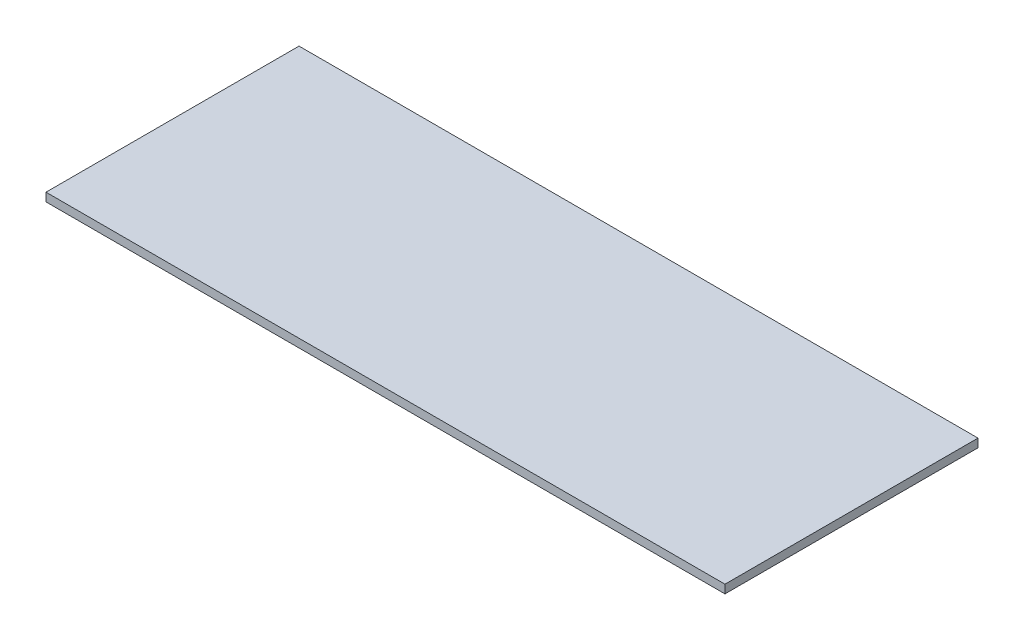
from build123d import *

# Parameters (mm, degrees)
SKETCH1_W           = 762
SKETCH1_H           = 177.8
BOSS_EXTRUDE1_DEPTH = 6.35
SKETCH5_W           = 774.7
SKETCH5_H           = 190.5
SKETCH5_W_2         = 762
SKETCH5_H_2         = 177.8
BOSS_EXTRUDE2_DEPTH = 6.35
SKETCH7_W           = 263.53
SKETCH7_H           = 190.5
CUT_EXTRUDE2_DEPTH  = 399.939729157


with BuildPart() as part:
    # Sketch1 → Boss-Extrude1 (new body)
    with BuildSketch(Plane(origin=(0, 0, 0), x_dir=(1, 0, 0), z_dir=(0, 1, 0))):
        Rectangle(SKETCH1_W, SKETCH1_H)
    extrude(amount=BOSS_EXTRUDE1_DEPTH)

    # Sketch5 → Boss-Extrude2 (add)
    with BuildSketch(Plane(origin=(0, 6.35, 0), x_dir=(1, 0, 0), z_dir=(0, 1, 0))):
        Rectangle(SKETCH5_W, SKETCH5_H)
        Rectangle(SKETCH5_W_2, SKETCH5_H_2, mode=Mode.SUBTRACT)
    extrude(amount=-BOSS_EXTRUDE2_DEPTH)

    # Sketch7 → Cut-Extrude2 (cut, through all)
    with BuildSketch(Plane.XZ):
        with Locations((255.585, 0)):
            Rectangle(SKETCH7_W, SKETCH7_H)
    extrude(amount=-CUT_EXTRUDE2_DEPTH, mode=Mode.SUBTRACT)


solid = part.part
